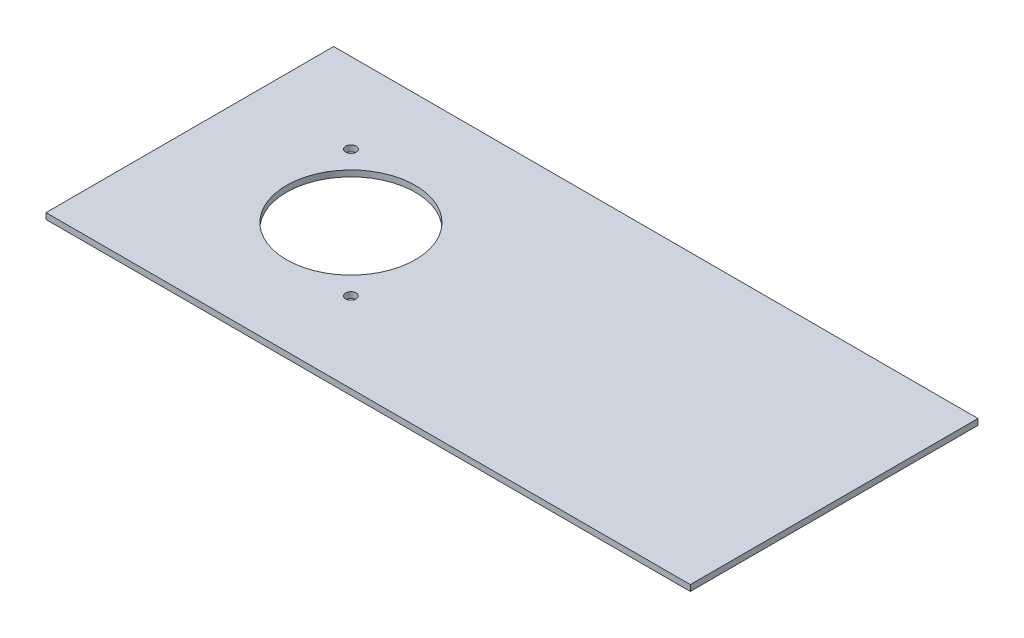
from build123d import *

# Parameters (mm, degrees)
SKETCH1_W           = 215
SKETCH1_H           = 96
SKETCH1_R           = 1.75
SKETCH1_R_2         = 21.5
BOSS_EXTRUDE1_DEPTH = 2


with BuildPart() as part:
    # Sketch1 → Boss-Extrude1 (new body)
    with BuildSketch(Plane(origin=(0, 0, 0), x_dir=(1, 0, 0), z_dir=(0, 1, 0))):
        Rectangle(SKETCH1_W, SKETCH1_H)
        with Locations(Location((-74.963203436, 21.213203436, 0), (0, 0, 270))):
            Circle(SKETCH1_R, mode=Mode.SUBTRACT)
        with Locations(Location((-32.536796564, -21.213203436, 0), (0, 0, 270))):
            Circle(SKETCH1_R, mode=Mode.SUBTRACT)
        with Locations(Location((-53.75, 0, 0), (0, 0, 270))):
            Circle(SKETCH1_R_2, mode=Mode.SUBTRACT)
    extrude(amount=BOSS_EXTRUDE1_DEPTH)


solid = part.part
